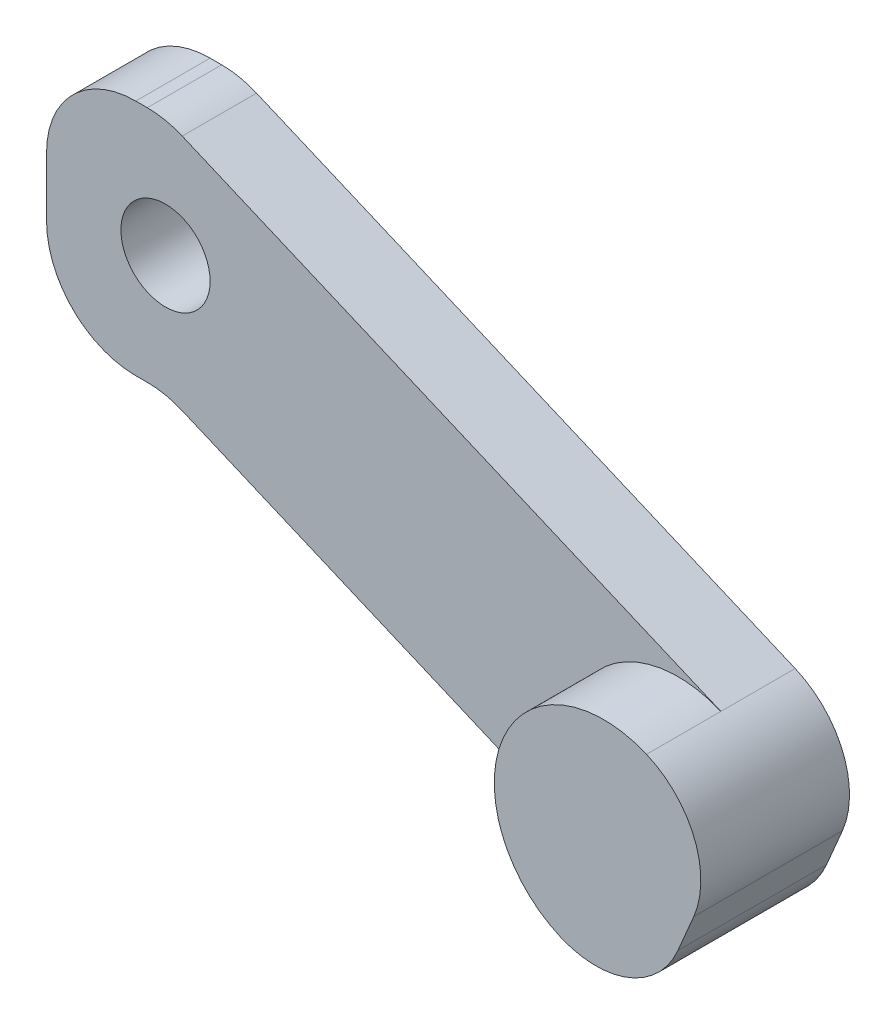
from build123d import *

# Parameters (mm, degrees)
ESBO_O1_R                = 3
RESSALTO_EXTRUS_O1_DEPTH = 5
FILETE1_R                = 6
RESSALTO_EXTRUS_O2_START = 5
RESSALTO_EXTRUS_O2_DEPTH = 5


with BuildPart() as part:
    # Esboço1 → Ressalto-extrusão1 (new body)
    with BuildSketch(Plane.XY):
        Polygon((-8, -8), (-8, 8), (0, 8), (42.879830598, -10.223928004), (37.120169402, -23.776071996), (0, -8), align=None)
        Circle(ESBO_O1_R, mode=Mode.SUBTRACT)
    extrude(amount=RESSALTO_EXTRUS_O1_DEPTH)

    # Filete1
    filete1_edges = [part.edges().sort_by_distance(p)[0] for p in [
        (-8, -8, 2.5),
        (0, -8, 2.5),
        (37.120169402, -23.776071996, 2.5),
        (42.879830598, -10.223928004, 2.5),
        (0, 8, 2.5),
        (-8, 8, 2.5),
    ]]
    fillet(filete1_edges, radius=FILETE1_R)

    # Esboço2 → Ressalto-extrusão2 (add)
    with BuildSketch(Plane.XY.offset(5).offset(RESSALTO_EXTRUS_O2_START)):
        with BuildLine():
            Line((39.467013244, -18.254086485), (40.532986756, -15.745913515))
            ThreePointArc((40.532986756, -15.745913515), (40.575103841, -11.153905468), (37.357845087, -7.877084162))
            ThreePointArc((37.357845087, -7.877084162), (36.552086472, -7.588681558), (35.718304651, -7.395728495))
            ThreePointArc((35.718304651, -7.395728495), (27.413539889, -12.579084175), (31.598183891, -21.429228154))
            ThreePointArc((31.598183891, -21.429228154), (36.190191938, -21.471345238), (39.467013244, -18.254086485))
        make_face()
    extrude(amount=-RESSALTO_EXTRUS_O2_DEPTH)


solid = part.part
